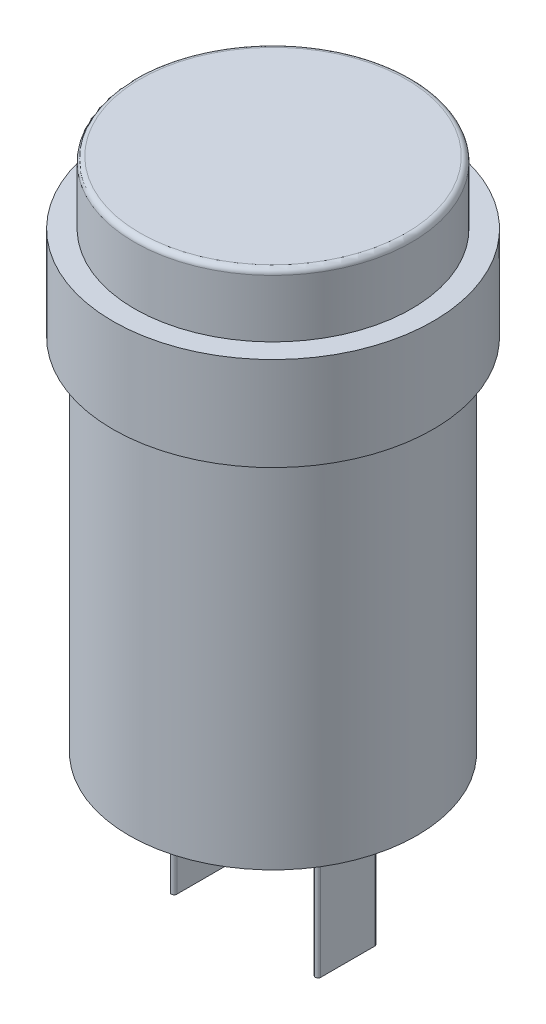
from build123d import *

# Parameters (mm, degrees)
SKETCH1_R           = 8.9
BOSS_EXTRUDE1_DEPTH = 5.2
SKETCH2_R           = 8
BOSS_EXTRUDE2_DEPTH = 20
BOSS_EXTRUDE3_DEPTH = 8
SKETCH4_R           = 7.7
BOSS_EXTRUDE4_DEPTH = 3.5
FILLET1_R           = 0.3
SCALE1_SCALE        = 1.375


with BuildPart() as part:
    # Sketch1 → Boss-Extrude1 (new body)
    with BuildSketch(Plane(origin=(0, 0, 0), x_dir=(1, 0, 0), z_dir=(0, 1, 0))):
        with Locations(Location((0, 0, 0), (0, 0, 270))):
            Circle(SKETCH1_R)
    extrude(amount=BOSS_EXTRUDE1_DEPTH)

    # Sketch2 → Boss-Extrude2 (add)
    with BuildSketch(Plane.XZ):
        with Locations(Location((0, 0, 0), (0, 0, 90))):
            Circle(SKETCH2_R)
    extrude(amount=BOSS_EXTRUDE2_DEPTH)

    # Sketch3 → Boss-Extrude3 (add)
    with BuildSketch(Plane.XZ.offset(20)):
        with BuildLine():
            Line((4.15, 1.5), (4.15, -1.5))
            ThreePointArc((4.15, -1.5), (4, -1.65), (3.85, -1.5))
            Line((3.85, -1.5), (3.85, 1.5))
            ThreePointArc((3.85, 1.5), (4, 1.65), (4.15, 1.5))
        make_face()
        with BuildLine():
            Line((-3.85, 1.5), (-3.85, -1.5))
            ThreePointArc((-3.85, -1.5), (-4, -1.65), (-4.15, -1.5))
            Line((-4.15, -1.5), (-4.15, 1.5))
            ThreePointArc((-4.15, 1.5), (-4, 1.65), (-3.85, 1.5))
        make_face()
    extrude(amount=BOSS_EXTRUDE3_DEPTH)

    # Sketch4 → Boss-Extrude4 (add)
    with BuildSketch(Plane(origin=(0, 5.2, 0), x_dir=(1, 0, 0), z_dir=(0, 1, 0))):
        with Locations(Location((0, 0, 0), (0, 0, 270))):
            Circle(SKETCH4_R)
    extrude(amount=BOSS_EXTRUDE4_DEPTH)

    # Fillet1
    fillet1_edges = [part.edges().sort_by_distance(p)[0] for p in [
        (0, 8.7, -7.7),
    ]]
    fillet(fillet1_edges, radius=FILLET1_R)


with BuildPart() as part_1:
    # Scale1: scaled about (0, -5.466249854, 0)
    add(part.part.scale(SCALE1_SCALE).moved(Location((0, 2.049843695, 0))))


solid = part_1.part
